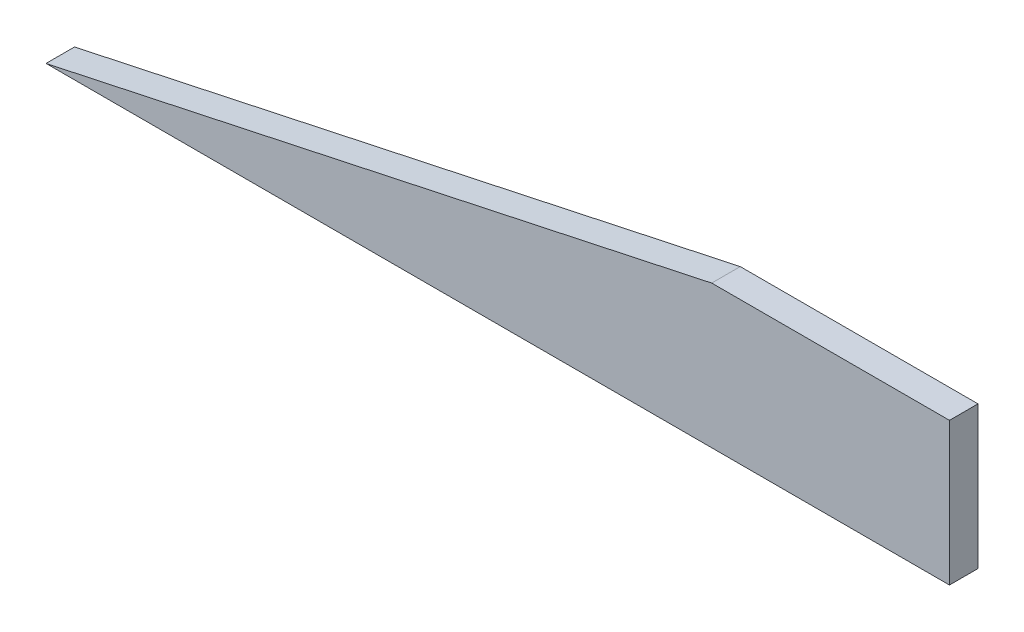
from build123d import *

# Parameters (mm, degrees)
BOSS_EXTRU_1_DEPTH = 30


with BuildPart() as part:
    # Esquisse1 → Boss.-Extru.1 (new body)
    with BuildSketch(Plane.XY):
        Polygon((0, 0), (0, 150), (-250, 150), (-950, 0), align=None)
    extrude(amount=BOSS_EXTRU_1_DEPTH)


solid = part.part
